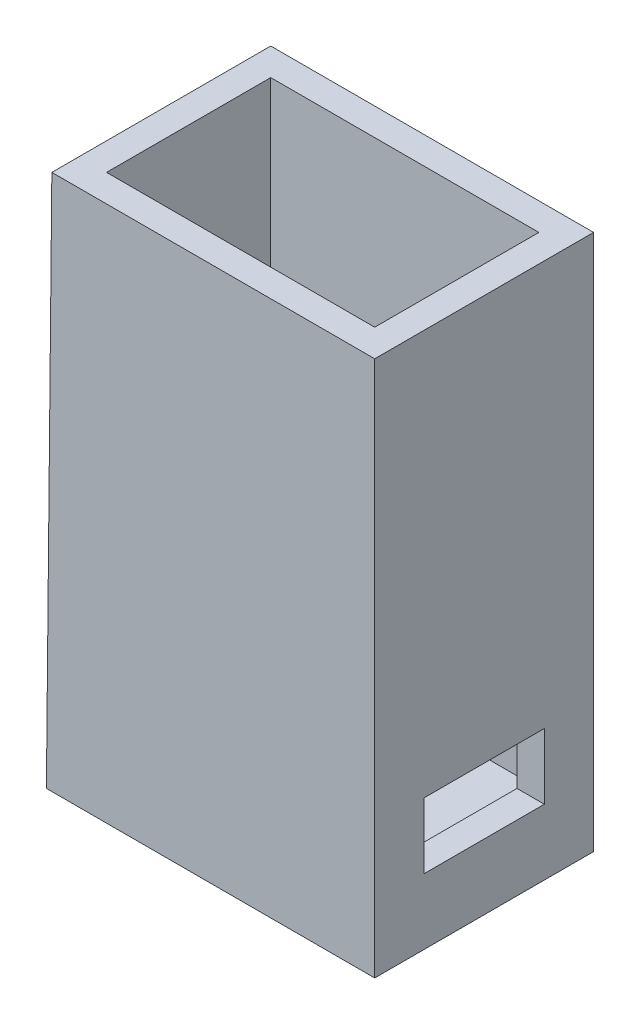
from build123d import *

# Parameters (mm, degrees)
BOSS_EXTRUDE1_DEPTH = 25.4
SKETCH3_W           = 13.97
SKETCH3_H           = 7.62
CUT_EXTRUDE1_DEPTH  = 78.261522765
SKETCH4_W           = 31.117855917
SKETCH4_H           = 3.175
BOSS_EXTRUDE2_DEPTH = 55.88


with BuildPart() as part:
    # Sketch2 → Boss-Extrude1 (new body)
    with BuildSketch(Plane.XY):
        Polygon((0, 0), (0.632144083, 62.23), (3.807144083, 62.23), (3.807144083, 6.35), (34.925, 6.35), (34.925, 62.23), (38.1, 62.23), (38.1, 0), align=None)
    extrude(amount=BOSS_EXTRUDE1_DEPTH)

    # Sketch3 → Cut-Extrude1 (cut, through all)
    with BuildSketch(Plane(origin=(38.1, 0, 0), x_dir=(0, 0, -1), z_dir=(1, 0, 0))):
        with Locations((-12.7, 11.43)):
            Rectangle(SKETCH3_W, SKETCH3_H)
    extrude(amount=-CUT_EXTRUDE1_DEPTH, mode=Mode.SUBTRACT)

    # Sketch4 → Boss-Extrude2 (add)
    with BuildSketch(Plane(origin=(0, 6.35, 0), x_dir=(1, 0, 0), z_dir=(0, 1, 0))):
        with Locations((19.366072042, -1.5875)):
            Rectangle(SKETCH4_W, SKETCH4_H)
        with Locations((19.366072042, -23.8125)):
            Rectangle(SKETCH4_W, SKETCH4_H)
    extrude(amount=BOSS_EXTRUDE2_DEPTH)


solid = part.part
